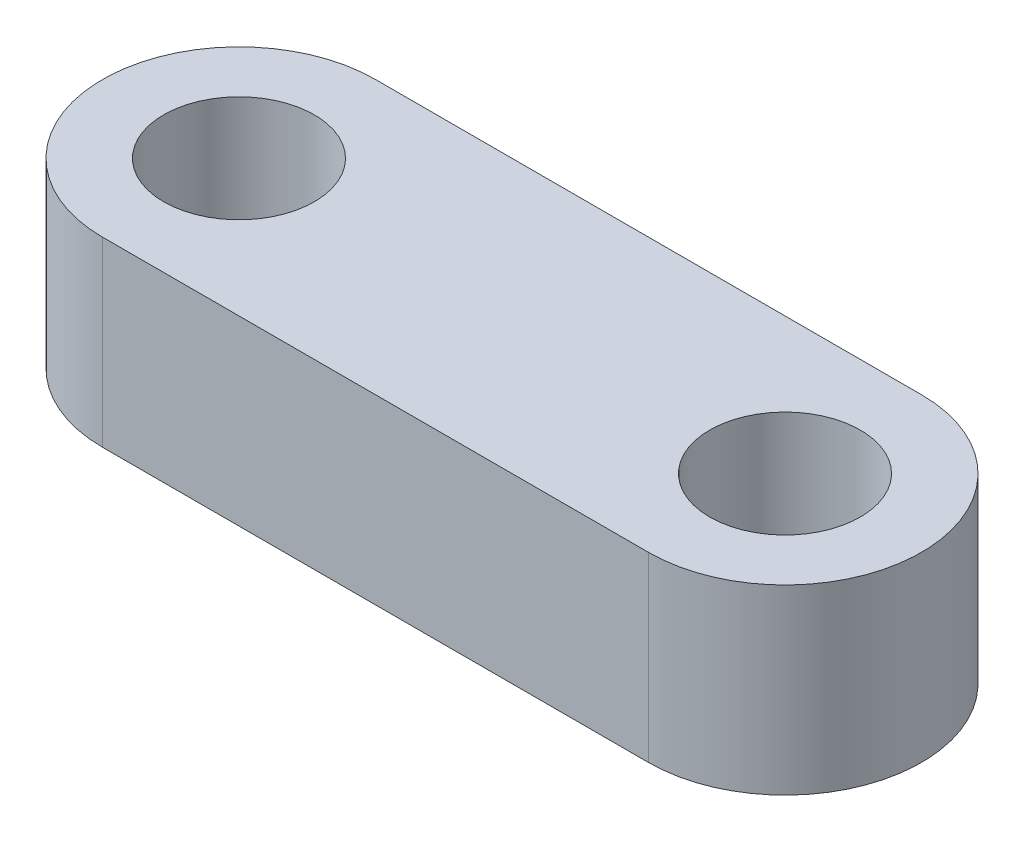
from build123d import *

# Parameters (mm, degrees)
SKETCH1_R           = 2.6289
BOSS_EXTRUDE1_DEPTH = 6.35


with BuildPart() as part:
    # Sketch1 → Boss-Extrude1 (new body)
    with BuildSketch(Plane(origin=(0, 0, 0), x_dir=(1, 0, 0), z_dir=(0, 1, 0))):
        with BuildLine():
            Line((0, 4.7625), (19.05, 4.7625))
            ThreePointArc((19.05, 4.7625), (23.8125, 0), (19.05, -4.7625))
            Line((19.05, -4.7625), (0, -4.7625))
            ThreePointArc((0, -4.7625), (-4.7625, 0), (0, 4.7625))
        make_face()
        with Locations(Location((0, 0, 0), (0, 0, 270))):
            Circle(SKETCH1_R, mode=Mode.SUBTRACT)
        with Locations(Location((19.05, 0, 0), (0, 0, 270))):
            Circle(SKETCH1_R, mode=Mode.SUBTRACT)
    extrude(amount=BOSS_EXTRUDE1_DEPTH)


solid = part.part
